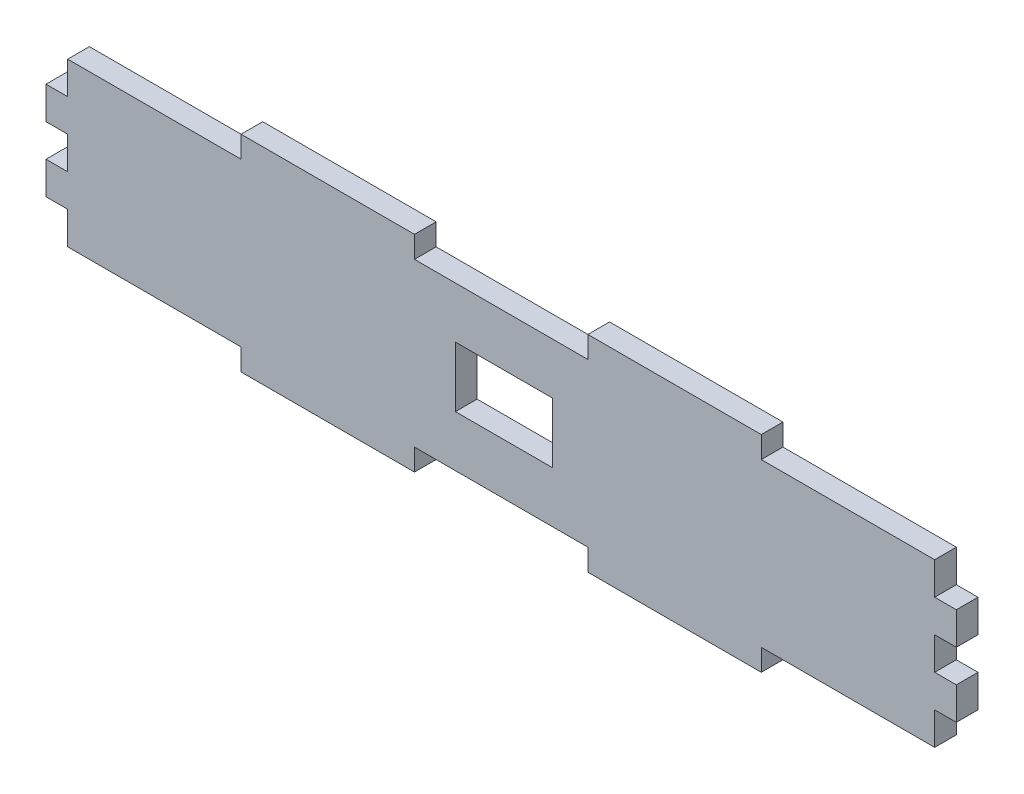
from build123d import *

# Parameters (mm, degrees)
SKETCH1_W           = 13.42
SKETCH1_H           = 8.34
BOSS_EXTRUDE1_DEPTH = 3


with BuildPart() as part:
    # Sketch1 → Boss-Extrude1 (new body)
    with BuildSketch(Plane.XY):
        Polygon((-69.416939444, 21.72071936), (-69.416939444, 17.22071936), (-72.416939444, 17.22071936), (-72.416939444, 12.72071936), (-69.416939444, 12.72071936), (-69.416939444, 8.22071936), (-72.416939444, 8.22071936), (-72.416939444, 3.72071936), (-69.416939444, 3.72071936), (-69.416939444, -0.77928064), (-45.416939444, -0.77928064), (-45.416939444, -3.77928064), (-21.416939444, -3.77928064), (-21.416939444, -0.77928064), (2.583060556, -0.77928064), (2.583060556, -3.77928064), (26.583060556, -3.77928064), (26.583060556, -0.77928064), (50.583060556, -0.77928064), (50.583060556, 3.72071936), (53.583060556, 3.72071936), (53.583060556, 8.22071936), (50.583060556, 8.22071936), (50.583060556, 12.72071936), (53.583060556, 12.72071936), (53.583060556, 17.22071936), (50.583060556, 17.22071936), (50.583060556, 21.72071936), (26.583060556, 21.72071936), (26.583060556, 24.72071936), (2.583060556, 24.72071936), (2.583060556, 21.72071936), (-21.416939444, 21.72071936), (-21.416939444, 24.72071936), (-45.416939444, 24.72071936), (-45.416939444, 21.72071936), align=None)
        with Locations((-9.038639097, 10.47071936)):
            Rectangle(SKETCH1_W, SKETCH1_H, mode=Mode.SUBTRACT)
    extrude(amount=BOSS_EXTRUDE1_DEPTH)


solid = part.part
